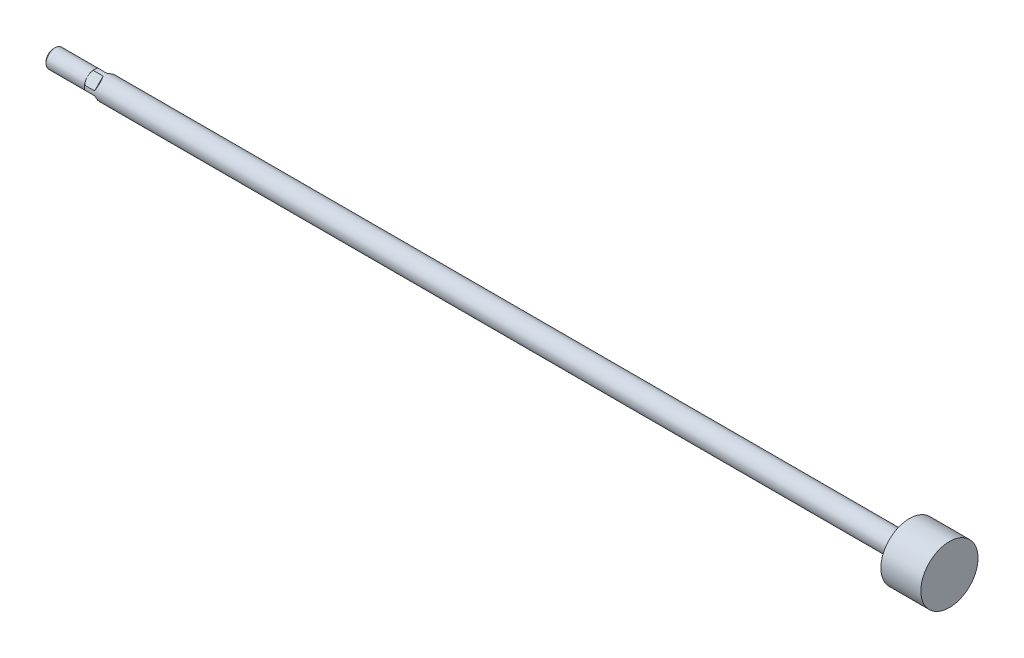
from build123d import *

# Parameters (mm, degrees)
CUT_EXTRUDE_1_DEPTH      = 5
CUT_EXTRUDE_1_DEPTH_BACK = 5
CUT_EXTRUDE_2_DEPTH      = 5
CUT_EXTRUDE_2_DEPTH_BACK = 5


with BuildPart() as part:
    # 草图1 → 旋转1 (revolve)
    with BuildSketch(Plane.XY):
        Polygon((0, 0), (0, 4.233), (0.767, 5), (22, 5), (23, 6), (471, 6), (471, 15.75), (493, 15.75), (493, 0), align=None)
    revolve(axis=Axis((493, 0, 0), (-1, 0, 0)))

    # 草图2 → 切除-拉伸1 (cut, two sides: drawn at the far end of the back side and taken through both)
    with BuildSketch(Plane(origin=(0, 0, 0), x_dir=(1, 0, 0), z_dir=(0, -0.7071067811865477, 0.7071067811865475)).offset(-CUT_EXTRUDE_1_DEPTH_BACK)):
        Polygon((-5, -12), (35.4, -12), (28.4, -5), (22, -5), (19.8, -7.2), (19.8, -10), (-3, -10), (-3, 10), (19.8, 10), (19.8, 7.2), (22, 5), (28.4, 5), (35.4, 12), (-5, 12), align=None)
    extrude(amount=CUT_EXTRUDE_1_DEPTH + CUT_EXTRUDE_1_DEPTH_BACK, mode=Mode.SUBTRACT)

    # 草图3 → 切除-拉伸2 (cut, two sides: drawn at the far end of the back side and taken through both)
    with BuildSketch(Plane(origin=(0, 0, 0), x_dir=(-1, 0, 0), z_dir=(0, -0.7071067811865477, -0.7071067811865475)).offset(-CUT_EXTRUDE_2_DEPTH_BACK)):
        Polygon((5, 12), (-35.4, 12), (-28.4, 5), (-22, 5), (-19.8, 7.2), (-19.8, 10), (3, 10), (3, -10), (-19.8, -10), (-19.8, -7.2), (-22, -5), (-28.4, -5), (-35.4, -12), (5, -12), align=None)
    extrude(amount=CUT_EXTRUDE_2_DEPTH + CUT_EXTRUDE_2_DEPTH_BACK, mode=Mode.SUBTRACT)


solid = part.part
